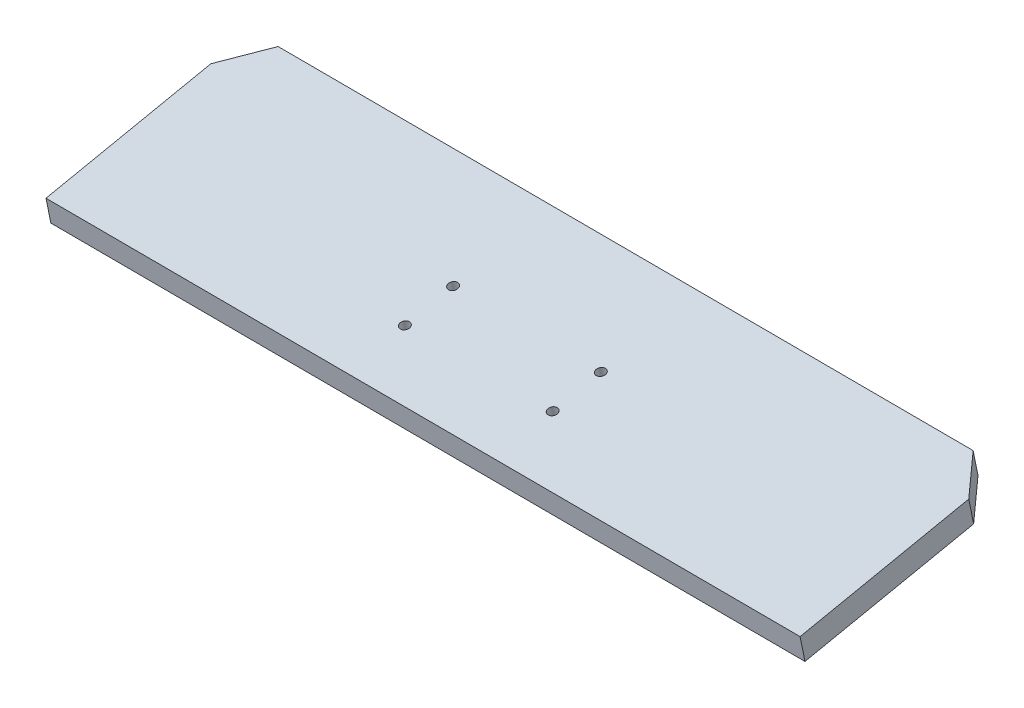
from build123d import *

# Parameters (mm, degrees)
BOSS_EXTRUDE1_DEPTH = 6.35
SKETCH4_R           = 1.190625
CUT_EXTRUDE2_DEPTH  = 398.434844364


with BuildPart() as part:
    # Sketch2 → Boss-Extrude1 (new body)
    with BuildSketch(Plane(origin=(0.683346332, 150.385179261, 31.029771586), x_dir=(-0.9999900978792948, 0.004358374370466655, 0.0008992864979534574), z_dir=(0.004450184643196504, 0.979359636230067, 0.20207646765507412))):
        Polygon((-88.422343932, 329.663853712), (90.808907549, 329.663853712), (97.754590844, 340.296232729), (97.754590844, 383.735739743), (-96.711451797, 383.735739743), (-96.711451797, 339.285739743), align=None)
    extrude(amount=BOSS_EXTRUDE1_DEPTH)

    # Sketch4 → Cut-Extrude2 (cut, through all)
    with BuildSketch(Plane(origin=(0.711605005, 156.604112951, 32.312957155), x_dir=(0.9999900978792948, -0.0043583743704666555, -0.0008992864979534572), z_dir=(0.004450184643196505, 0.9793596362300672, 0.2020764676550741))):
        with Locations((17.856718191, -355.665986236)):
            Circle(SKETCH4_R)
        with Locations((17.856718191, -368.365986236)):
            Circle(SKETCH4_R)
        with Locations((-20.243281809, -368.365986236)):
            Circle(SKETCH4_R)
        with Locations((-20.243281809, -355.665986236)):
            Circle(SKETCH4_R)
    extrude(amount=-CUT_EXTRUDE2_DEPTH, mode=Mode.SUBTRACT)


solid = part.part
